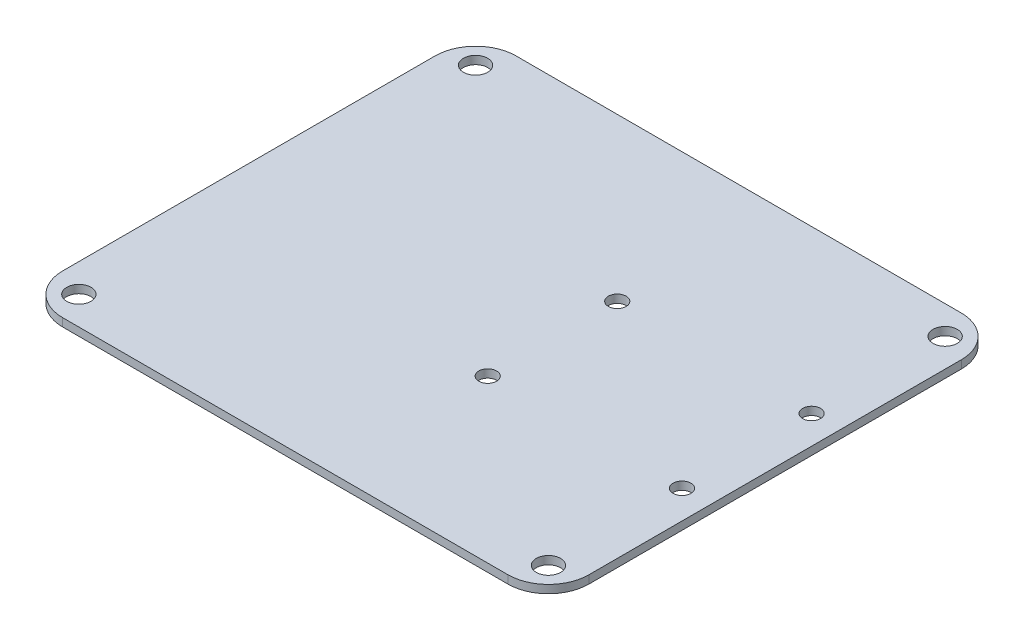
from build123d import *

# Parameters (mm, degrees)
SKETCH1_W           = 65
SKETCH1_H           = 56
SKETCH1_R           = 1.5
SKETCH1_R_2         = 1.1
BOSS_EXTRUDE1_DEPTH = 1
FILLET2_R           = 5


with BuildPart() as part:
    # Sketch1 → Boss-Extrude1 (new body)
    with BuildSketch(Plane(origin=(0, 0, 0), x_dir=(1, 0, 0), z_dir=(0, 1, 0))):
        with Locations((29, -24.5)):
            Rectangle(SKETCH1_W, SKETCH1_H)
        with Locations(Location((0, 0, 0), (0, 0, 270))):
            Circle(SKETCH1_R, mode=Mode.SUBTRACT)
        with Locations(Location((58, 0, 0), (0, 0, 270))):
            Circle(SKETCH1_R, mode=Mode.SUBTRACT)
        with Locations(Location((0, -49, 0), (0, 0, 270))):
            Circle(SKETCH1_R, mode=Mode.SUBTRACT)
        with Locations(Location((58, -49, 0), (0, 0, 270))):
            Circle(SKETCH1_R, mode=Mode.SUBTRACT)
        with Locations(Location((34, -16.5, 0), (0, 0, 270))):
            Circle(SKETCH1_R_2, mode=Mode.SUBTRACT)
        with Locations(Location((58, -16.5, 0), (0, 0, 270))):
            Circle(SKETCH1_R_2, mode=Mode.SUBTRACT)
        with Locations(Location((34, -32.5, 0), (0, 0, 270))):
            Circle(SKETCH1_R_2, mode=Mode.SUBTRACT)
        with Locations(Location((58, -32.5, 0), (0, 0, 270))):
            Circle(SKETCH1_R_2, mode=Mode.SUBTRACT)
    extrude(amount=BOSS_EXTRUDE1_DEPTH)

    # Fillet2
    fillet2_edges = [part.edges().sort_by_distance(p)[0] for p in [
        (61.5, 0.5, 52.5),
        (-3.5, 0.5, 52.5),
        (-3.5, 0.5, -3.5),
        (61.5, 0.5, -3.5),
    ]]
    fillet(fillet2_edges, radius=FILLET2_R)


solid = part.part
